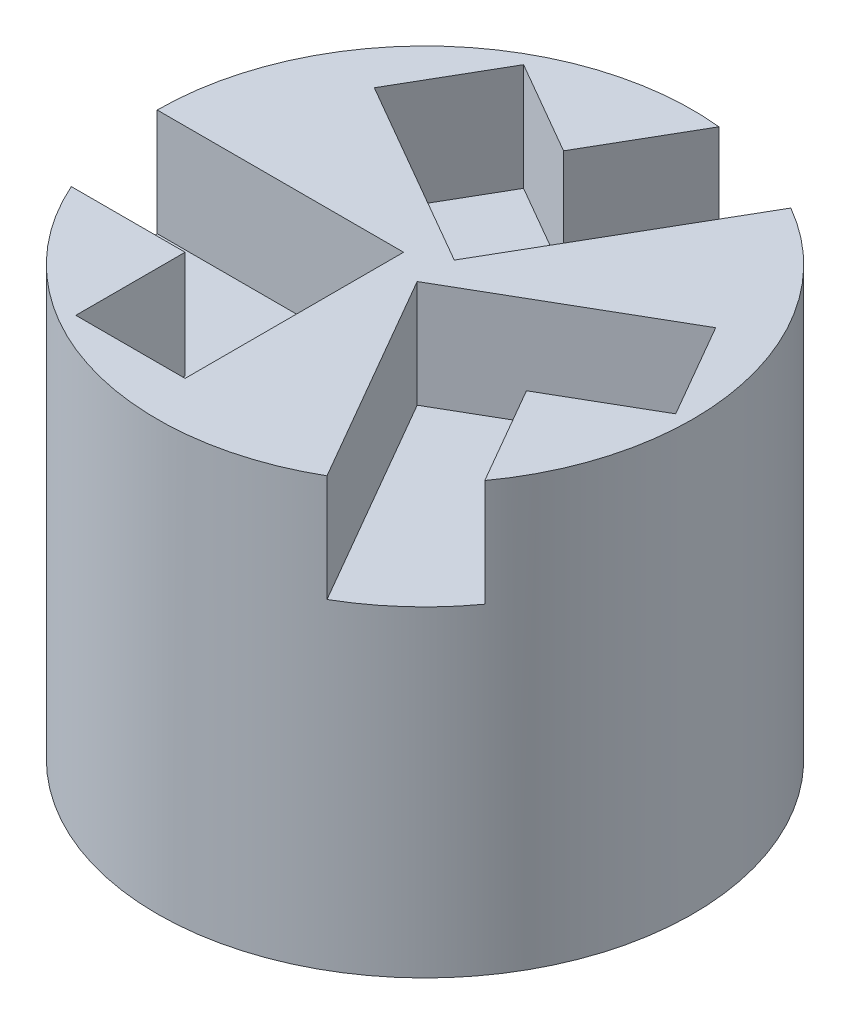
from build123d import *

# Parameters (mm, degrees)
SKETCH1_R           = 25
BOSS_EXTRUDE1_DEPTH = 40
CUT_EXTRUDE1_START  = -10
CUT_EXTRUDE1_DEPTH  = 10
CIRPATTERN1_COUNT   = 3
SKETCH7_R           = 15.1
CUT_EXTRUDE3_DEPTH  = 8.7


with BuildPart() as part:
    # Sketch1 → Boss-Extrude1 (new body)
    with BuildSketch(Plane(origin=(0, 0, 0), x_dir=(1, 0, 0), z_dir=(0, 1, 0))):
        with Locations(Location((0, 0, 0), (0, 0, 270))):
            Circle(SKETCH1_R)
    extrude(amount=BOSS_EXTRUDE1_DEPTH)

    # Sketch2 → Cut-Extrude1 (cut)
    with BuildSketch(Plane(origin=(0, 40, 0), x_dir=(1, 0, 0), z_dir=(0, 1, 0)).offset(CUT_EXTRUDE1_START)):
        with BuildLine():
            Line((-25, 0), (-2, 0))
            Line((-2, 0), (-2, -20.4))
            Line((-2, -20.4), (-12.2, -20.4))
            Line((-12.2, -20.4), (-12.2, -10.2))
            Line((-12.2, -10.2), (-22.824548188, -10.2))
            ThreePointArc((-22.824548188, -10.2), (-24.450089005, -5.214704943), (-25, 0))
        make_face()
    cut_extrude1 = extrude(amount=CUT_EXTRUDE1_DEPTH, mode=Mode.SUBTRACT)

    # CirPattern1: Cut-Extrude1 ×3 about axis
    cirpattern1_axis = Axis((0, 0, 0), (0, 1, 0))
    for i in range(1, CIRPATTERN1_COUNT):
        add(cut_extrude1.rotate(cirpattern1_axis, i * 360 / CIRPATTERN1_COUNT), mode=Mode.SUBTRACT)

    # Sketch7 → Cut-Extrude3 (cut)
    with BuildSketch(Plane.XZ):
        with Locations(Location((0, 0, 0), (0, 0, 270))):
            Circle(SKETCH7_R)
    extrude(amount=-CUT_EXTRUDE3_DEPTH, mode=Mode.SUBTRACT)


solid = part.part
